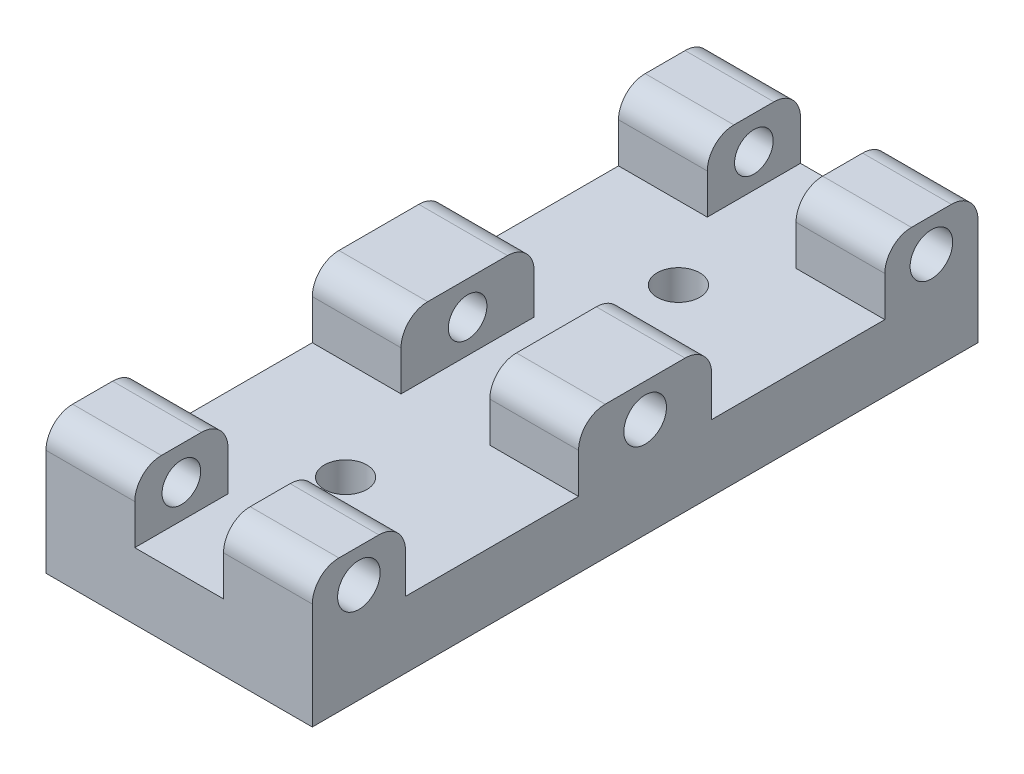
from build123d import *

# Parameters (mm, degrees)
SKETCH1_W           = 20
SKETCH1_H           = 50
BOSS_EXTRUDE1_DEPTH = 5
SKETCH2_R           = 1.6
CUT_EXTRUDE1_DEPTH  = 28.386127875
SKETCH3_W           = 20
SKETCH3_H           = 10
SKETCH3_H_2         = 7
BOSS_EXTRUDE2_DEPTH = 5
SKETCH4_R           = 1.45
CUT_EXTRUDE2_DEPTH  = 34.541019662
SKETCH5_W           = 6.666666666
SKETCH5_H           = 5
CUT_EXTRUDE3_DEPTH  = 52.961524227
CUT_EXTRUDE4_REACH  = 35.541
SKETCH6_R           = 1.6
FILLET1_R           = 2


with BuildPart() as part:
    # Sketch1 → Boss-Extrude1 (new body)
    with BuildSketch(Plane(origin=(0, 0, 0), x_dir=(1, 0, 0), z_dir=(0, 1, 0))):
        Rectangle(SKETCH1_W, SKETCH1_H)
    extrude(amount=BOSS_EXTRUDE1_DEPTH)

    # Sketch2 → Cut-Extrude1 (cut, through all)
    with BuildSketch(Plane(origin=(0, 5, 0), x_dir=(1, 0, 0), z_dir=(0, 1, 0))):
        with Locations(Location((0, 12.5, 0), (0, 0, 270))):
            Circle(SKETCH2_R)
        with Locations(Location((0, -12.5, 0), (0, 0, 270))):
            Circle(SKETCH2_R)
    extrude(amount=-CUT_EXTRUDE1_DEPTH, mode=Mode.SUBTRACT)

    # Sketch3 → Boss-Extrude2 (add)
    with BuildSketch(Plane(origin=(0, 5, 0), x_dir=(1, 0, 0), z_dir=(0, 1, 0))):
        Rectangle(SKETCH3_W, SKETCH3_H)
        with Locations((0, -21.5)):
            Rectangle(SKETCH3_W, SKETCH3_H_2)
        with Locations((0, 21.5)):
            Rectangle(SKETCH3_W, SKETCH3_H_2)
    extrude(amount=BOSS_EXTRUDE2_DEPTH)

    # Sketch4 → Cut-Extrude2 (cut, through all)
    with BuildSketch(Plane.ZY.offset(10)):
        with Locations((-21.5, 7.5)):
            Circle(SKETCH4_R)
        with Locations((0, 7.5)):
            Circle(SKETCH4_R)
        with Locations((21.5, 7.5)):
            Circle(SKETCH4_R)
    extrude(amount=-CUT_EXTRUDE2_DEPTH, mode=Mode.SUBTRACT)

    # Sketch5 → Cut-Extrude3 (cut, through all)
    with BuildSketch(Plane(origin=(0, 0, -25), x_dir=(-1, 0, 0), z_dir=(0, 0, -1))):
        with Locations((0, 7.5)):
            Rectangle(SKETCH5_W, SKETCH5_H)
    extrude(amount=-CUT_EXTRUDE3_DEPTH, mode=Mode.SUBTRACT)

    # Sketch6 → Cut-Extrude4 (cut, up to next)
    with BuildSketch(Plane(origin=(10, 0, 0), x_dir=(0, 0, -1), z_dir=(1, 0, 0)), mode=Mode.PRIVATE) as cut_extrude4_sk1:
        with Locations((21.5, 7.5)):
            Circle(SKETCH6_R)
    cut_extrude4_tool1 = extrude(cut_extrude4_sk1.sketch, amount=-CUT_EXTRUDE4_REACH, mode=Mode.PRIVATE) & part.part
    # Sketch6 → Cut-Extrude4 (cut, up to next)
    with BuildSketch(Plane(origin=(10, 0, 0), x_dir=(0, 0, -1), z_dir=(1, 0, 0)), mode=Mode.PRIVATE) as cut_extrude4_sk2:
        with Locations((0, 7.5)):
            Circle(SKETCH6_R)
    cut_extrude4_tool2 = extrude(cut_extrude4_sk2.sketch, amount=-CUT_EXTRUDE4_REACH, mode=Mode.PRIVATE) & part.part
    # Sketch6 → Cut-Extrude4 (cut, up to next)
    with BuildSketch(Plane(origin=(10, 0, 0), x_dir=(0, 0, -1), z_dir=(1, 0, 0)), mode=Mode.PRIVATE) as cut_extrude4_sk3:
        with Locations((-21.5, 7.5)):
            Circle(SKETCH6_R)
    cut_extrude4_tool3 = extrude(cut_extrude4_sk3.sketch, amount=-CUT_EXTRUDE4_REACH, mode=Mode.PRIVATE) & part.part
    add(cut_extrude4_tool1.solids().sort_by_distance((10, 7.5, -21.5))[0], mode=Mode.SUBTRACT)
    add(cut_extrude4_tool2.solids().sort_by_distance((10, 7.5, 0))[0], mode=Mode.SUBTRACT)
    add(cut_extrude4_tool3.solids().sort_by_distance((10, 7.5, 21.5))[0], mode=Mode.SUBTRACT)

    # Fillet1
    fillet1_edges = [part.edges().sort_by_distance(p)[0] for p in [
        (6.666666667, 10, -25),
        (-6.666666667, 10, -18),
        (6.666666667, 10, 18),
        (-6.666666667, 10, 25),
        (6.666666667, 10, -5),
        (-6.666666667, 10, 5),
        (-6.666666667, 10, -25),
        (6.666666667, 10, -18),
        (-6.666666667, 10, 18),
        (6.666666667, 10, 25),
        (-6.666666667, 10, -5),
        (6.666666667, 10, 5),
    ]]
    fillet(fillet1_edges, radius=FILLET1_R)


solid = part.part
